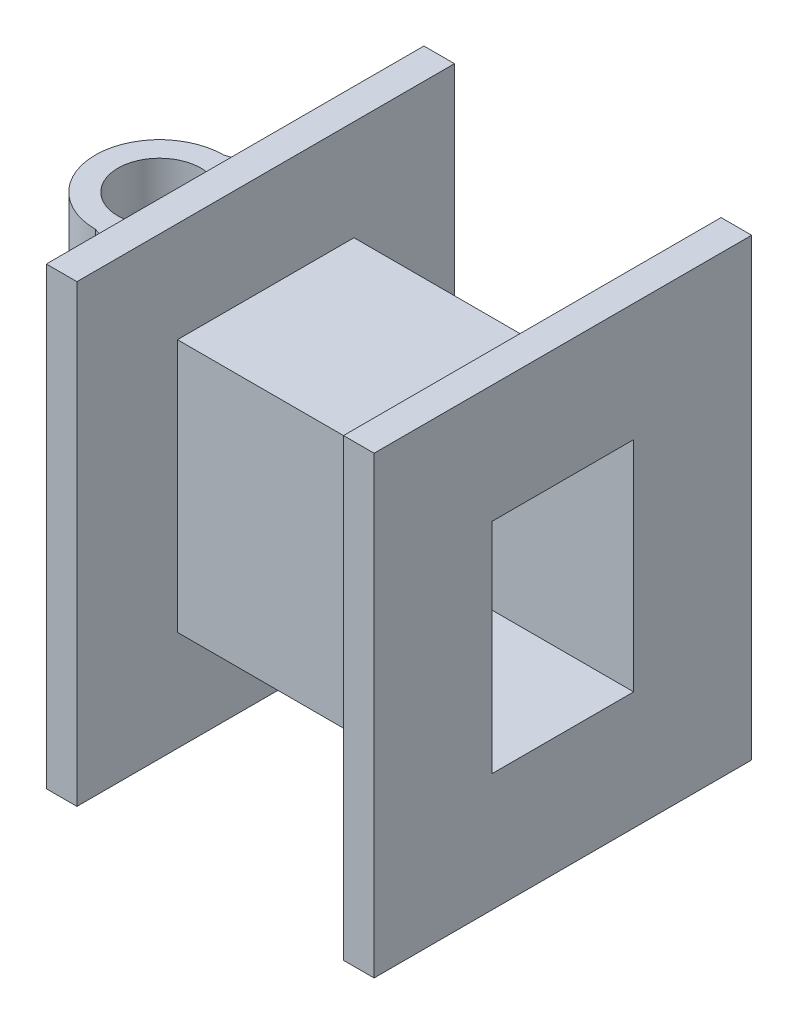
from build123d import *

# Parameters (mm, degrees)
SKETCH1_W                = 20.2
SKETCH1_H                = 29
SKETCH1_W_2              = 16.2
SKETCH1_H_2              = 25
BOSS_EXTRUDE1_DEPTH      = 18.75
BOSS_EXTRUDE2_DEPTH      = 3.5
BOSS_EXTRUDE2_DEPTH_BACK = 2
SKETCH2_R                = 4.75
SKETCH3_W                = 43.2
SKETCH3_H                = 52
SKETCH3_W_2              = 16.2
SKETCH3_H_2              = 25
BOSS_EXTRUDE4_DEPTH      = 3.5


with BuildPart() as part:
    # Sketch1 → Boss-Extrude1 (new, symmetric)
    with BuildSketch(Plane(origin=(0, 0, 0), x_dir=(0, 0, -1), z_dir=(1, 0, 0))):
        Rectangle(SKETCH1_W, SKETCH1_H)
        Rectangle(SKETCH1_W_2, SKETCH1_H_2, mode=Mode.SUBTRACT)
    extrude(amount=BOSS_EXTRUDE1_DEPTH, both=True)

    # Sketch2 → Boss-Extrude2 (add, two sides: drawn at the far end of the back side and taken through both)
    with BuildSketch(Plane(origin=(0, 14.5, 0), x_dir=(1, 0, 0), z_dir=(0, 1, 0)).offset(-BOSS_EXTRUDE2_DEPTH_BACK)):
        with BuildLine():
            Line((-18.75, -10.1), (-18.75, 10.1))
            Line((-18.75, 10.1), (-27.403040645, 7.346959355))
            ThreePointArc((-27.403040645, 7.346959355), (-34.75, 0), (-27.403040645, -7.346959355))
            Line((-27.403040645, -7.346959355), (-18.75, -10.1))
        make_face()
        with Locations(Location((-27.403040645, 0, 0), (0, 0, 270))):
            Circle(SKETCH2_R, mode=Mode.SUBTRACT)
    extrude(amount=BOSS_EXTRUDE2_DEPTH + BOSS_EXTRUDE2_DEPTH_BACK)

    # Sketch3 → Boss-Extrude4 (add)
    with BuildSketch(Plane(origin=(18.75, 0, 0), x_dir=(0, 0, -1), z_dir=(1, 0, 0))):
        Rectangle(SKETCH3_W, SKETCH3_H)
        Rectangle(SKETCH3_W_2, SKETCH3_H_2, mode=Mode.SUBTRACT)
    boss_extrude4 = extrude(amount=-BOSS_EXTRUDE4_DEPTH)

    # Mirror1: Boss-Extrude4 across plane
    add(boss_extrude4.mirror(Plane(origin=(0, 0, 0), x_dir=(0, 0, 1), z_dir=(1, 0, 0))))


solid = part.part
